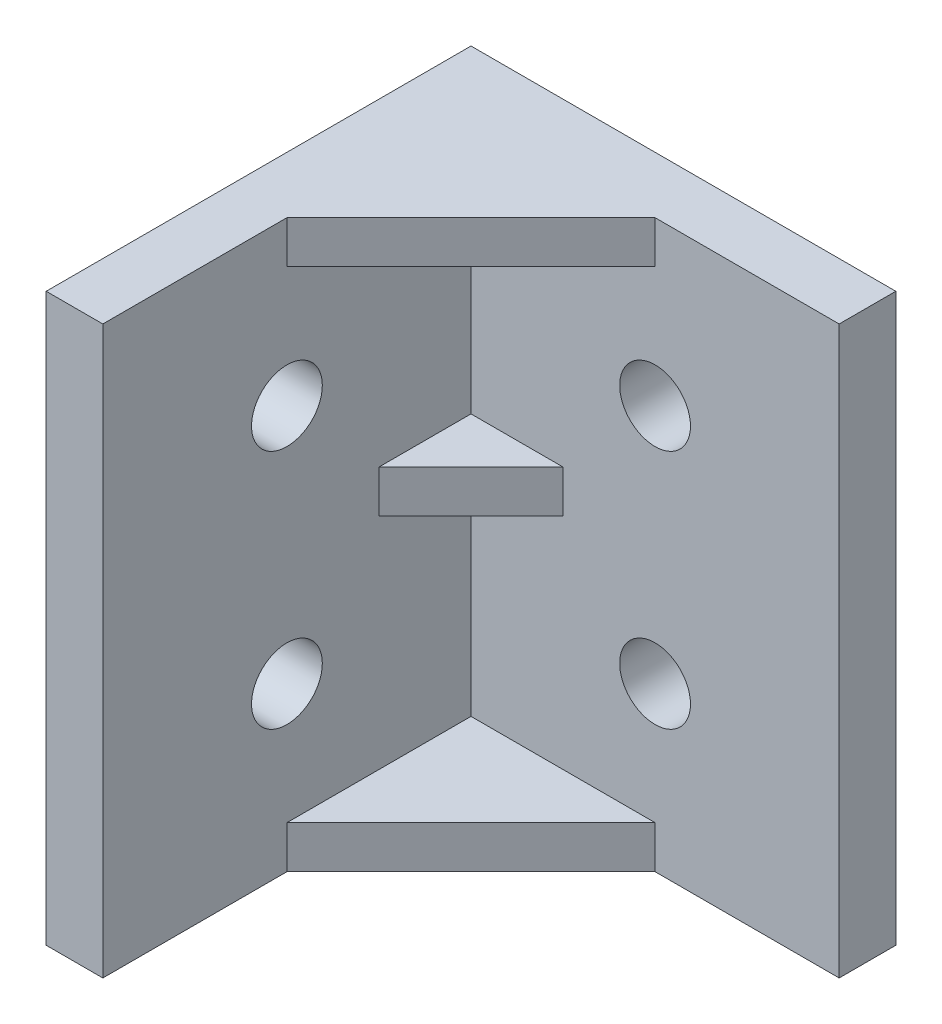
from build123d import *

# Parameters (mm, degrees)
SALIENTE_EXTRUIR1_DEPTH = 20
SALIENTE_EXTRUIR2_DEPTH = 3
SALIENTE_EXTRUIR3_DEPTH = 3
SALIENTE_EXTRUIR4_DEPTH = 1.5
CROQUIS5_R              = 2.5
CORTAR_EXTRUIR1_DEPTH   = 38.238203332
CROQUIS6_R              = 2.5
CORTAR_EXTRUIR2_DEPTH   = 41.360446068


with BuildPart() as part:
    # Croquis1 → Saliente-Extruir1 (new, symmetric)
    with BuildSketch(Plane(origin=(0, 0, 0), x_dir=(1, 0, 0), z_dir=(0, 1, 0))):
        Polygon((-19.515220747, 8.373775577), (6.484779253, 8.373775577), (6.484779253, 12.373775577), (-23.515220747, 12.373775577), (-23.515220747, -17.626224423), (-19.515220747, -17.626224423), align=None)
    extrude(amount=SALIENTE_EXTRUIR1_DEPTH, both=True)

    # Croquis2 → Saliente-Extruir2 (add)
    with BuildSketch(Plane.XZ.offset(20)):
        Polygon((-6.515220747, -8.373775577), (-19.515220747, -8.373775577), (-19.515220747, 4.626224423), align=None)
    extrude(amount=-SALIENTE_EXTRUIR2_DEPTH)

    # Croquis3 → Saliente-Extruir3 (add)
    with BuildSketch(Plane(origin=(0, 20, 0), x_dir=(1, 0, 0), z_dir=(0, 1, 0))):
        Polygon((-6.515220747, 8.373775577), (-19.515220747, -4.626224423), (-19.515220747, 8.373775577), align=None)
    extrude(amount=-SALIENTE_EXTRUIR3_DEPTH)

    # Croquis4 → Saliente-Extruir4 (add, symmetric)
    with BuildSketch(Plane(origin=(0, 0, 0), x_dir=(1, 0, 0), z_dir=(0, 1, 0))):
        Polygon((-13.015220747, 8.373775577), (-19.515220747, 1.873775577), (-19.515220747, 8.373775577), align=None)
    extrude(amount=SALIENTE_EXTRUIR4_DEPTH, both=True)

    # Croquis5 → Cortar-Extruir1 (cut, through all)
    with BuildSketch(Plane(origin=(-19.515220747, 0, 0), x_dir=(0, 0, -1), z_dir=(1, 0, 0))):
        with Locations((-4.626224423, -8.5)):
            Circle(CROQUIS5_R)
        with Locations((-4.626224423, 8.5)):
            Circle(CROQUIS5_R)
    extrude(amount=-CORTAR_EXTRUIR1_DEPTH, mode=Mode.SUBTRACT)

    # Croquis6 → Cortar-Extruir2 (cut, through all)
    with BuildSketch(Plane.XY.offset(-8.373775577)):
        with Locations((-6.515220747, -8.5)):
            Circle(CROQUIS6_R)
        with Locations((-6.515220747, 8.5)):
            Circle(CROQUIS6_R)
    extrude(amount=-CORTAR_EXTRUIR2_DEPTH, mode=Mode.SUBTRACT)


solid = part.part
